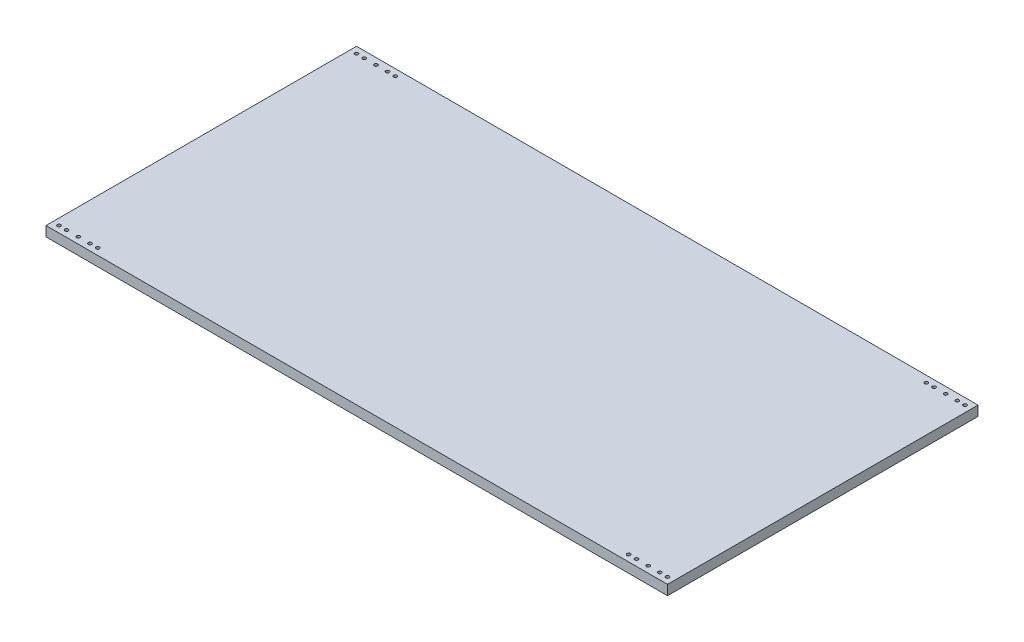
from build123d import *

# Parameters (mm, degrees)
SKETCH1_W            = 1201
SKETCH1_H            = 600
BOSS_EXTRUDE1_DEPTH  = 19.05
M6_CLEARANCE_HOLE1_D = 6.6


with BuildPart() as part:
    # Sketch1 → Boss-Extrude1 (new body)
    with BuildSketch(Plane(origin=(0, 0, 0), x_dir=(1, 0, 0), z_dir=(0, 1, 0))):
        Rectangle(SKETCH1_W, SKETCH1_H)
    extrude(amount=BOSS_EXTRUDE1_DEPTH)

    # M6 Clearance Hole1 (through all)
    with Locations(Plane.XZ):
        with Locations((-588, 287.5), (-573, 287.5), (-550.5, 287.5), (-528, 287.5), (-513, 287.5), (-588, -287.5), (-573, -287.5), (-550.5, -287.5), (-528, -287.5), (-513, -287.5), (513, -287.5), (528, -287.5), (550.5, -287.5), (573, -287.5), (588, -287.5), (513, 287.5), (528, 287.5), (550.5, 287.5), (573, 287.5), (588, 287.5)):
            Hole(M6_CLEARANCE_HOLE1_D / 2)


solid = part.part
